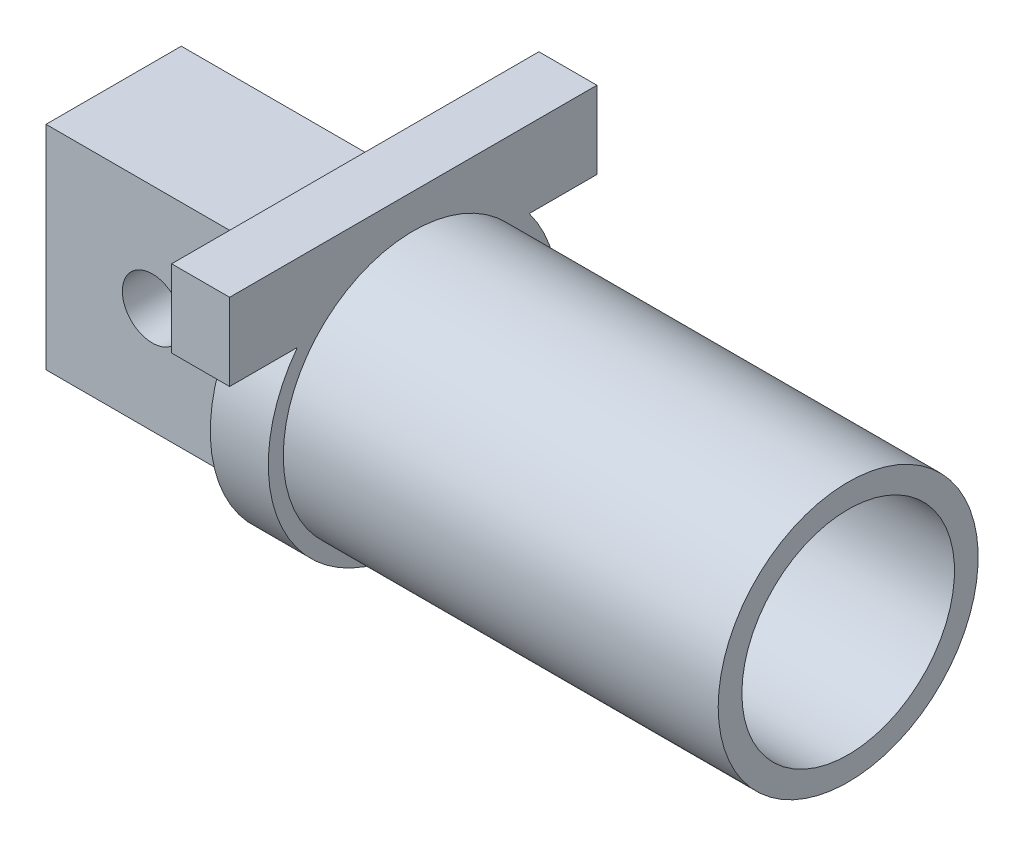
from build123d import *

# Parameters (mm, degrees)
TONGUE_SKETCH_W   = 27
TONGUE_SKETCH_H   = 22
TONGUE_DEPTH      = 7
PAD_SKETCH_W      = 6
PAD_SKETCH_H      = 8
SWITCH_PAD_DEPTH  = 19
PIN_HOLE_SKETCH_R = 3.1
PIN_HOLE_DEPTH    = 10


with BuildPart() as part:
    # Stem Sketch → Stem (revolve)
    with BuildSketch(Plane.XY):
        Polygon((14, 0), (14, 15), (20, 15), (20, 13.45), (65, 13.45), (65, 11), (30, 11), (30, 0), align=None)
    revolve(axis=Axis((-3000, 0, 0), (1, 0, 0)))

    # Tongue Sketch → Tongue (add, symmetric)
    with BuildSketch(Plane.XY):
        with Locations((2.5, 0)):
            Rectangle(TONGUE_SKETCH_W, TONGUE_SKETCH_H)
    extrude(amount=TONGUE_DEPTH, both=True)

    # Pad Sketch → Switch Pad (add, symmetric)
    with BuildSketch(Plane.XY):
        with Locations((17, 13)):
            Rectangle(PAD_SKETCH_W, PAD_SKETCH_H)
    extrude(amount=SWITCH_PAD_DEPTH, both=True)

    # Pin Hole Sketch → Pin Hole (cut, symmetric)
    with BuildSketch(Plane.XY):
        Circle(PIN_HOLE_SKETCH_R)
    extrude(amount=PIN_HOLE_DEPTH, both=True, mode=Mode.SUBTRACT)


solid = part.part
